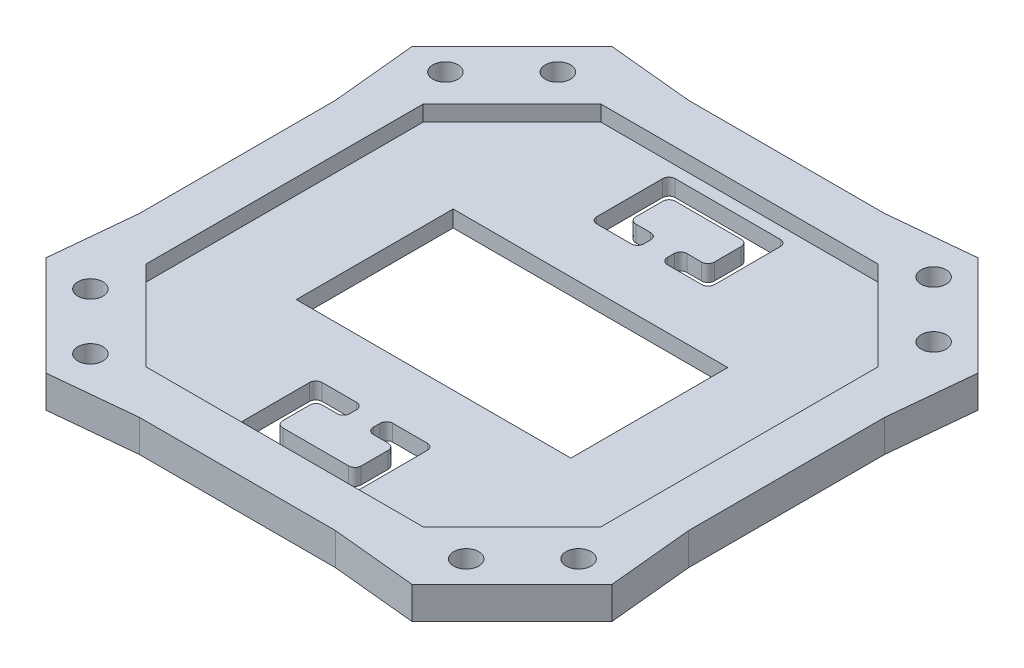
from build123d import *

# Parameters (mm, degrees)
SKETCH1_R           = 1.6
BOSS_EXTRUDE2_DEPTH = 4.1
CUT_EXTRUDE1_DEPTH  = 2
CUT_EXTRUDE4_DEPTH  = 52.043216983
SKETCH9_W           = 35
SKETCH9_H           = 20
CUT_EXTRUDE5_DEPTH  = 10


with BuildPart() as part:
    # Sketch1 → Boss-Extrude2 (new body)
    with BuildSketch(Plane(origin=(0, 0, 0), x_dir=(1, 0, 0), z_dir=(0, 1, 0))):
        Polygon((-12.5, 35), (12.5, 35), (23.334523779, 36.062445841), (36.062445841, 23.334523779), (35, 12.5), (35, -12.5), (36.062445841, -23.334523779), (23.334523779, -36.062445841), (12.5, -35), (-12.5, -35), (-23.334523779, -36.062445841), (-36.062445841, -23.334523779), (-35, -12.5), (-35, 12.5), (-36.062445841, 23.334523779), (-23.334523779, 36.062445841), align=None)
        with Locations((22.627416998, 31.112698372)):
            Circle(SKETCH1_R, mode=Mode.SUBTRACT)
        with Locations((29.79056362, 23.94955175)):
            Circle(SKETCH1_R, mode=Mode.SUBTRACT)
        with Locations((31.112698372, -22.627416998)):
            Circle(SKETCH1_R, mode=Mode.SUBTRACT)
        with Locations((23.94955175, -29.79056362)):
            Circle(SKETCH1_R, mode=Mode.SUBTRACT)
        with Locations((-22.627416998, -31.112698372)):
            Circle(SKETCH1_R, mode=Mode.SUBTRACT)
        with Locations((-29.79056362, -23.94955175)):
            Circle(SKETCH1_R, mode=Mode.SUBTRACT)
        with Locations((-31.112698372, 22.627416998)):
            Circle(SKETCH1_R, mode=Mode.SUBTRACT)
        with Locations((-23.94955175, 29.79056362)):
            Circle(SKETCH1_R, mode=Mode.SUBTRACT)
    extrude(amount=BOSS_EXTRUDE2_DEPTH)

    # Sketch2 → Cut-Extrude1 (cut)
    with BuildSketch(Plane(origin=(0, 4.1, 0), x_dir=(1, 0, 0), z_dir=(0, 1, 0))):
        Polygon((-17.669047558, 29), (17.669047558, 29), (29, 17.669047558), (29, -17.669047558), (17.669047558, -29), (-17.669047558, -29), (-29, -17.669047558), (-29, 17.669047558), align=None)
    extrude(amount=-CUT_EXTRUDE1_DEPTH, mode=Mode.SUBTRACT)

    # Sketch8 → Cut-Extrude4 (cut, through all)
    with BuildSketch(Plane(origin=(0, 2.1, 0), x_dir=(1, 0, 0), z_dir=(0, 1, 0))):
        with BuildLine():
            Line((-1.5, 19.18174342), (-1.5, 18.3))
            ThreePointArc((-1.5, 18.3), (-1.734314575, 17.734314575), (-2.3, 17.5))
            Line((-2.3, 17.5), (-6.7, 17.5))
            ThreePointArc((-6.7, 17.5), (-7.265685425, 17.734314575), (-7.5, 18.3))
            Line((-7.5, 18.3), (-7.5, 26.7))
            ThreePointArc((-7.5, 26.7), (-7.265685425, 27.265685425), (-6.7, 27.5))
            Line((-6.7, 27.5), (6.7, 27.5))
            ThreePointArc((6.7, 27.5), (7.265685425, 27.265685425), (7.5, 26.7))
            Line((7.5, 26.7), (7.5, 18.3))
            ThreePointArc((7.5, 18.3), (7.265685425, 17.734314575), (6.7, 17.5))
            Line((6.7, 17.5), (2.3, 17.5))
            ThreePointArc((2.3, 17.5), (1.734314575, 17.734314575), (1.5, 18.3))
            Line((1.5, 18.3), (1.5, 19.18174342))
            ThreePointArc((1.5, 19.18174342), (1.734314575, 19.747428845), (2.3, 19.98174342))
            Line((2.3, 19.98174342), (4.2, 19.98174342))
            ThreePointArc((4.2, 19.98174342), (4.765685425, 20.216057995), (5, 20.78174342))
            Line((5, 20.78174342), (5, 24.21825658))
            ThreePointArc((5, 24.21825658), (4.765685425, 24.783942005), (4.2, 25.01825658))
            Line((4.2, 25.01825658), (-4.2, 25.01825658))
            ThreePointArc((-4.2, 25.01825658), (-4.765685425, 24.783942005), (-5, 24.21825658))
            Line((-5, 24.21825658), (-5, 20.78174342))
            ThreePointArc((-5, 20.78174342), (-4.765685425, 20.216057995), (-4.2, 19.98174342))
            Line((-4.2, 19.98174342), (-2.3, 19.98174342))
            ThreePointArc((-2.3, 19.98174342), (-1.734314575, 19.747428845), (-1.5, 19.18174342))
        make_face()
        with BuildLine():
            Line((2.3, -17.5), (6.7, -17.5))
            ThreePointArc((6.7, -17.5), (7.265685425, -17.734314575), (7.5, -18.3))
            Line((7.5, -18.3), (7.5, -26.7))
            ThreePointArc((7.5, -26.7), (7.265685425, -27.265685425), (6.7, -27.5))
            Line((6.7, -27.5), (-6.7, -27.5))
            ThreePointArc((-6.7, -27.5), (-7.265685425, -27.265685425), (-7.5, -26.7))
            Line((-7.5, -26.7), (-7.5, -18.3))
            ThreePointArc((-7.5, -18.3), (-7.265685425, -17.734314575), (-6.7, -17.5))
            Line((-6.7, -17.5), (-2.3, -17.5))
            ThreePointArc((-2.3, -17.5), (-1.734314575, -17.734314575), (-1.5, -18.3))
            Line((-1.5, -18.3), (-1.5, -19.18174342))
            ThreePointArc((-1.5, -19.18174342), (-1.734314575, -19.747428845), (-2.3, -19.98174342))
            Line((-2.3, -19.98174342), (-4.2, -19.98174342))
            ThreePointArc((-4.2, -19.98174342), (-4.765685425, -20.216057995), (-5, -20.78174342))
            Line((-5, -20.78174342), (-5, -24.21825658))
            ThreePointArc((-5, -24.21825658), (-4.765685425, -24.783942005), (-4.2, -25.01825658))
            Line((-4.2, -25.01825658), (4.2, -25.01825658))
            ThreePointArc((4.2, -25.01825658), (4.765685425, -24.783942005), (5, -24.21825658))
            Line((5, -24.21825658), (5, -20.78174342))
            ThreePointArc((5, -20.78174342), (4.765685425, -20.216057995), (4.2, -19.98174342))
            Line((4.2, -19.98174342), (2.3, -19.98174342))
            ThreePointArc((2.3, -19.98174342), (1.734314575, -19.747428845), (1.5, -19.18174342))
            Line((1.5, -19.18174342), (1.5, -18.3))
            ThreePointArc((1.5, -18.3), (1.734314575, -17.734314575), (2.3, -17.5))
        make_face()
    extrude(amount=-CUT_EXTRUDE4_DEPTH, mode=Mode.SUBTRACT)

    # Sketch9 → Cut-Extrude5 (cut)
    with BuildSketch(Plane(origin=(0, 2.1, 0), x_dir=(1, 0, 0), z_dir=(0, 1, 0))):
        Rectangle(SKETCH9_W, SKETCH9_H)
    extrude(amount=-CUT_EXTRUDE5_DEPTH, mode=Mode.SUBTRACT)


solid = part.part
